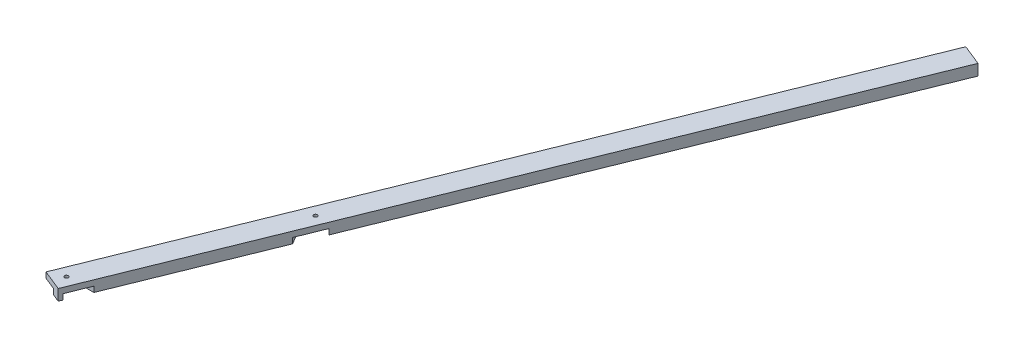
from build123d import *

# Parameters (mm, degrees)
BOSS_EXTRUDE3_DEPTH = 19.05
SKETCH6_R           = 3.175
CUT_EXTRUDE3_DEPTH  = 9.525
CUT_EXTRUDE4_DEPTH  = 9.525


with BuildPart() as part:
    # Sketch2 → Boss-Extrude3 (new body)
    with BuildSketch(Plane(origin=(0, 0, 0), x_dir=(1, 0, 0), z_dir=(0, 1, 0))):
        Polygon((-336.69350738, 0), (-316.143895572, 0), (-209.015455166, 264.828592555), (-221.216787177, 285.466092555), align=None)
        Polygon((-316.143895572, 0), (-295.594283764, 0), (-196.814123155, 244.191092555), (-209.015455166, 264.828592555), align=None)
        with BuildLine():
            Line((-322.659375, -16.106696225), (-316.143895572, 0))
            Line((-316.143895572, 0), (-336.69350738, 0))
            Line((-336.69350738, 0), (-341.509822647, -11.90625))
            Line((-341.509822647, -11.90625), (-326.793303775, -17.859375))
            ThreePointArc((-326.793303775, -17.859375), (-325.089331047, -16.126870931), (-322.659375, -16.106696225))
        make_face()
        with BuildLine():
            Line((-303.300388192, -19.05), (-295.594283764, 0))
            Line((-295.594283764, 0), (-316.143895572, 0))
            Line((-316.143895572, 0), (-322.659375, -16.106696225))
            ThreePointArc((-322.659375, -16.106696225), (-321.217429073, -17.275121043), (-320.675, -19.05))
            Line((-320.675, -19.05), (-303.300388192, -19.05))
        make_face()
        with BuildLine():
            Line((-327.557139607, -38.1), (-311.00649262, -38.1))
            Line((-311.00649262, -38.1), (-306.190177353, -26.19375))
            Line((-306.190177353, -26.19375), (-320.906696225, -20.240625))
            ThreePointArc((-320.906696225, -20.240625), (-325.040625, -21.993303775), (-326.793303775, -17.859375))
            Line((-326.793303775, -17.859375), (-341.509822647, -11.90625))
            Line((-341.509822647, -11.90625), (-348.653572647, -29.566072647))
            Line((-348.653572647, -29.566072647), (-327.557139607, -38.1))
        make_face()
        with BuildLine():
            Line((-320.906696225, -20.240625), (-306.190177353, -26.19375))
            Line((-306.190177353, -26.19375), (-303.300388192, -19.05))
            Line((-303.300388192, -19.05), (-320.675, -19.05))
            ThreePointArc((-320.675, -19.05), (-320.733462299, -19.656479808), (-320.906696225, -20.240625))
        make_face()
        Polygon((-313.333927353, -43.853572647), (-311.00649262, -38.1), (-327.557139607, -38.1), align=None)
        Polygon((-183.626593256, 296.748681841), (-178.833212823, 288.641092555), (143.866072647, 1086.375076786), (108.546427353, 1100.662576786), (-215.267964049, 300.171976915), (-193.321682542, 313.147088585), align=None)
        with BuildLine():
            Line((-196.814123155, 244.191092555), (-187.823667989, 266.416092555))
            Line((-187.823667989, 266.416092555), (-198.409151786, 284.320524764))
            ThreePointArc((-198.409151786, 284.320524764), (-199.787821823, 283.887463765), (-201.215625, 284.11028878))
            Line((-201.215625, 284.11028878), (-209.015455166, 264.828592555))
            Line((-209.015455166, 264.828592555), (-196.814123155, 244.191092555))
        make_face()
        with BuildLine():
            Line((-197.291932209, 288.669440769), (-183.626593256, 296.748681841))
            Line((-183.626593256, 296.748681841), (-193.321682542, 313.147088585))
            Line((-193.321682542, 313.147088585), (-215.267964049, 300.171976915))
            Line((-215.267964049, 300.171976915), (-221.216787177, 285.466092555))
            Line((-221.216787177, 285.466092555), (-209.015455166, 264.828592555))
            Line((-209.015455166, 264.828592555), (-201.215625, 284.11028878))
            ThreePointArc((-201.215625, 284.11028878), (-202.431501435, 289.124673395), (-197.291932209, 288.669440769))
        make_face()
        with BuildLine():
            Line((-187.823667989, 266.416092555), (-178.833212823, 288.641092555))
            Line((-178.833212823, 288.641092555), (-183.626593256, 296.748681841))
            Line((-183.626593256, 296.748681841), (-197.291932209, 288.669440769))
            ThreePointArc((-197.291932209, 288.669440769), (-196.962475287, 287.891188748), (-196.85, 287.053592555))
            ThreePointArc((-196.85, 287.053592555), (-197.26719806, 285.480330511), (-198.409151786, 284.320524764))
            Line((-198.409151786, 284.320524764), (-187.823667989, 266.416092555))
        make_face()
    extrude(amount=BOSS_EXTRUDE3_DEPTH)

    # Sketch6 → Cut-Extrude3 (cut)
    with BuildSketch(Plane.XZ):
        Polygon((-327.557139607, 38.1), (-348.653572647, 29.566072647), (-336.69350738, 0), (-295.594283764, 0), (-311.00649262, 38.1), align=None)
        with Locations(Location((-323.85, 19.05, 0), (0, 0, 270))):
            Circle(SKETCH6_R, mode=Mode.SUBTRACT)
    extrude(amount=-CUT_EXTRUDE3_DEPTH, mode=Mode.SUBTRACT)

    # Sketch7 → Cut-Extrude4 (cut)
    with BuildSketch(Plane.XZ):
        Polygon((-196.814123155, -244.191092555), (-221.216787177, -285.466092555), (-215.267964049, -300.171976915), (-193.321682542, -313.147088585), (-178.833212823, -288.641092555), align=None)
    extrude(amount=-CUT_EXTRUDE4_DEPTH, mode=Mode.SUBTRACT)


solid = part.part
